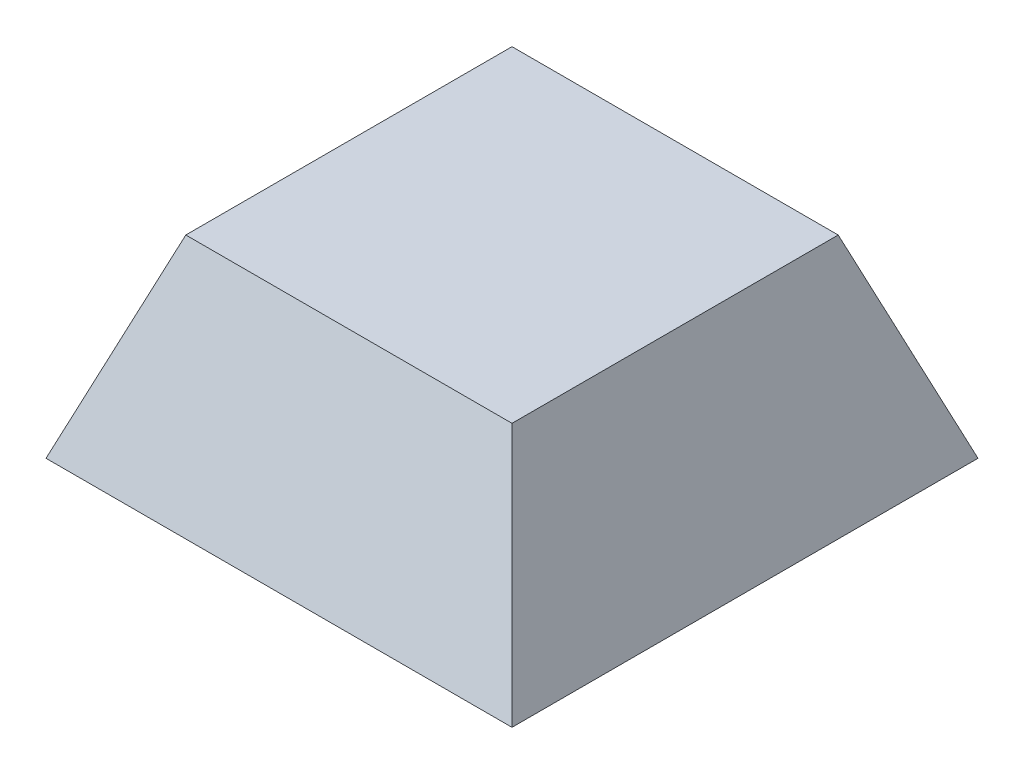
from build123d import *

# Parameters (mm, degrees)
SKETCH_1_W               = 20
SKETCH_1_H               = 20
EXTRUDE_1_DEPTH          = 8.3
SKETCH_2_OUTSIDE_W       = 27.896
SKETCH_2_OUTSIDE_H       = 16.196
CUT_EXTRUDE_1_DEPTH      = 24.851415052
CUT_EXTRUDE_2_DEPTH      = 17.397865715
CUT_EXTRUDE_2_DEPTH_BACK = 17.397865715
SKETCH_3_OUTSIDE_W       = 27.896
SKETCH_3_OUTSIDE_H       = 16.196


with BuildPart() as part:
    # 草图1 → 凸台-拉伸1 (new body)
    with BuildSketch(Plane(origin=(0, 0, 0), x_dir=(1, 0, 0), z_dir=(0, 1, 0))):
        Rectangle(SKETCH_1_W, SKETCH_1_H)
    extrude(amount=EXTRUDE_1_DEPTH)

    # 草图2 outside → 切除-拉伸1 (cut, through all)
    with BuildSketch(Plane.XY.offset(10)):
        with Locations((0, 4.15)):
            Rectangle(SKETCH_2_OUTSIDE_W, SKETCH_2_OUTSIDE_H)
        Polygon((-10, 0), (-7, 8.3), (7, 8.3), (10, 0), align=None, mode=Mode.SUBTRACT)
    extrude(amount=-CUT_EXTRUDE_1_DEPTH, mode=Mode.SUBTRACT)

    # 草图3 outside → 切除-拉伸2 (cut, two sides: drawn at the far end of the back side and taken through both)
    with BuildSketch(Plane(origin=(0, 0, 0), x_dir=(0, 0, -1), z_dir=(1, 0, 0)).offset(-CUT_EXTRUDE_2_DEPTH_BACK)):
        with Locations((0, 4.15)):
            Rectangle(SKETCH_3_OUTSIDE_W, SKETCH_3_OUTSIDE_H)
        Polygon((-10, 0), (10, 0), (7, 8.3), (-7, 8.3), align=None, mode=Mode.SUBTRACT)
    extrude(amount=CUT_EXTRUDE_2_DEPTH + CUT_EXTRUDE_2_DEPTH_BACK, mode=Mode.SUBTRACT)


solid = part.part
